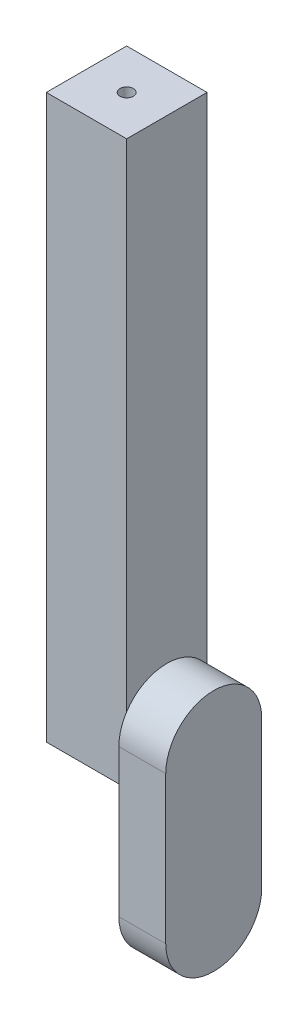
from build123d import *
from build123d.topology import SkipClean

# Parameters (mm, degrees)
SKETCH1_W                = 60
SKETCH1_H                = 60
BOSS_EXTRUDE1_DEPTH      = 500
BOSS_EXTRUDE6_DEPTH      = 2.5
BOSS_EXTRUDE6_DEPTH_BACK = 30
SKETCH2_R                = 12.5
CUT_EXTRUDE1_DEPTH       = 505.479930225
BOSS_EXTRUDE7_DEPTH      = 35
SKETCH7_W                = 30
SKETCH7_H                = 25
CUT_EXTRUDE2_DEPTH       = 15
SKETCH8_R                = 12.5
CUT_EXTRUDE3_DEPTH       = 22.5
SKETCH10_R               = 5
CUT_EXTRUDE4_DEPTH       = 20


with BuildPart() as part:
    # Sketch1 → Boss-Extrude1 (new body)
    with BuildSketch(Plane(origin=(0, 0, 0), x_dir=(1, 0, 0), z_dir=(0, 1, 0))):
        Rectangle(SKETCH1_W, SKETCH1_H)
    extrude(amount=BOSS_EXTRUDE1_DEPTH)

    # Sketch2 → Boss-Extrude6 (add, two sides: drawn at the far end of the back side and taken through both)
    with BuildSketch(Plane(origin=(30, 0, 0), x_dir=(0, 0, -1), z_dir=(1, 0, 0)).offset(-BOSS_EXTRUDE6_DEPTH_BACK)):
        Circle(SKETCH2_R)
    extrude(amount=BOSS_EXTRUDE6_DEPTH + BOSS_EXTRUDE6_DEPTH_BACK)

    # Sketch5 → Cut-Extrude1 (cut, through all)
    with SkipClean():  # the faces are left unmerged after this step: merging them gives an invalid solid
        with BuildSketch(Plane(origin=(30, 0, 0), x_dir=(0, 0, -1), z_dir=(1, 0, 0))):
            with BuildLine():
                Line((-30, 0), (-30, 80))
                Line((-30, 80), (30, 80))
                Line((30, 80), (30, 0))
                Line((30, 0), (12.5, 0))
                ThreePointArc((12.5, 0), (0, 12.5), (-12.5, 0))
                Line((-12.5, 0), (-30, 0))
            make_face()
        extrude(amount=-CUT_EXTRUDE1_DEPTH, mode=Mode.SUBTRACT)


with BuildPart() as cut_extrude1_piece_1:
    # of the separate pieces the step leaves, piece 1, a body of its own (cut_extrude1_pieces)
    add(part.part.solids().sort_by_distance((30, 80, -30))[0])



with BuildPart() as cut_extrude1_piece_2:
    # of the separate pieces the step leaves, piece 2, a body of its own (cut_extrude1_pieces)
    add(part.part.solids().sort_by_distance((0, 0, 12.5))[0])


with BuildPart() as cut_extrude1_piece_1_1:
    add(cut_extrude1_piece_1.part)

    add(cut_extrude1_piece_2.part)  # Boss-Extrude7 merges Cut-Extrude1 piece 2
    # Sketch6 → Boss-Extrude7 (add)
    with BuildSketch(Plane(origin=(30, 0, 0), x_dir=(0, 0, -1), z_dir=(1, 0, 0))):
        with BuildLine():
            Line((35.819788787, 110), (35.819788787, 0))
            ThreePointArc((35.819788787, 0), (0, -35.819788787), (-35.819788787, 0))
            Line((-35.819788787, 0), (-35.819788787, 110))
            ThreePointArc((-35.819788787, 110), (0, 145.819788787), (35.819788787, 110))
        make_face()
    extrude(amount=BOSS_EXTRUDE7_DEPTH)

    # Sketch7 → Cut-Extrude2 (cut)
    with BuildSketch(Plane.XZ):
        with Locations((-15, 0)):
            Rectangle(SKETCH7_W, SKETCH7_H)
    extrude(amount=-CUT_EXTRUDE2_DEPTH, mode=Mode.SUBTRACT)

    # Sketch8 → Cut-Extrude3 (cut)
    with BuildSketch(Plane.ZY):
        with Locations(Location((0, 0, 0), (0, 0, 180))):
            Circle(SKETCH8_R)
    extrude(amount=-CUT_EXTRUDE3_DEPTH, mode=Mode.SUBTRACT)

    # Sketch10 → Cut-Extrude4 (cut)
    with BuildSketch(Plane(origin=(0, 500, 0), x_dir=(1, 0, 0), z_dir=(0, 1, 0))):
        with Locations(Location((0, 0, 0), (0, 0, 270))):
            Circle(SKETCH10_R)
    extrude(amount=-CUT_EXTRUDE4_DEPTH, mode=Mode.SUBTRACT)


solid = cut_extrude1_piece_1_1.part
